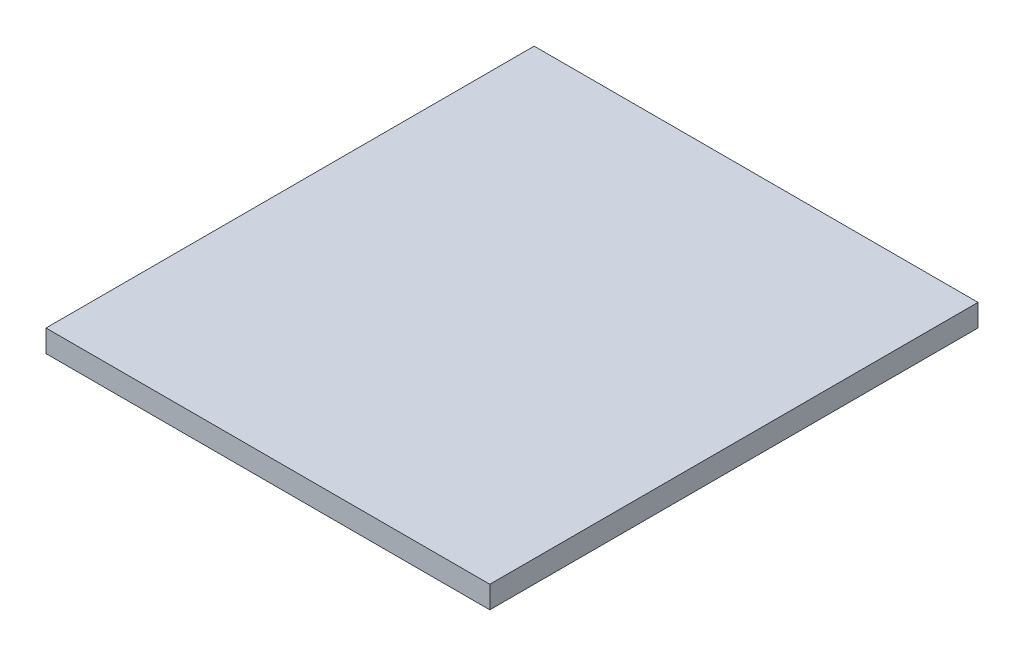
from build123d import *

# Parameters (mm, degrees)
CROQUIS1_W       = 2
CROQUIS1_H       = 2.2
EXTRUSI_N1_DEPTH = 0.1


with BuildPart() as part:
    # Croquis1 → Extrusión1 (new body)
    with BuildSketch(Plane(origin=(0, 0, 0), x_dir=(-1, 0, 0), z_dir=(0, 1, 0))):
        Rectangle(CROQUIS1_W, CROQUIS1_H)
    extrude(amount=EXTRUSI_N1_DEPTH)


solid = part.part
